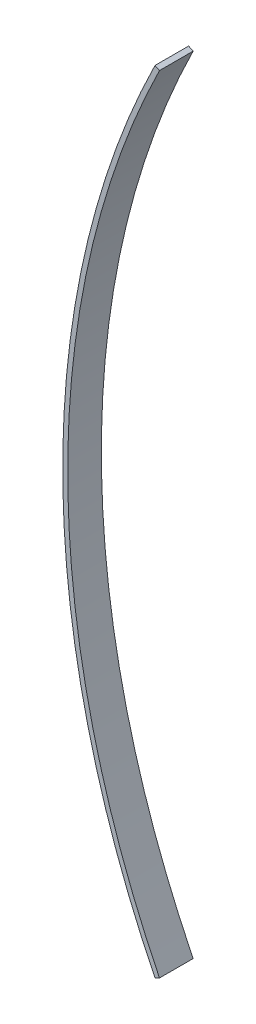
from build123d import *

# Parameters (mm, degrees)
EXTRUDE_THIN1_DEPTH = 6.75


with BuildPart() as part:
    # Sketch1 → Extrude-Thin1 (new body)
    with BuildSketch(Plane.XY):
        with BuildLine():
            ThreePointArc((18.665186435, 163.114004553), (0.25, 84.268032687), (18.665186435, 5.422060821))
            Line((18.665186435, 5.422060821), (17.768642539, 4.979105923))
            ThreePointArc((17.768642539, 4.979105923), (-0.75, 84.268032687), (17.768642539, 163.556959451))
            Line((17.768642539, 163.556959451), (18.665186435, 163.114004553))
        make_face()
    extrude(amount=-EXTRUDE_THIN1_DEPTH)


solid = part.part
